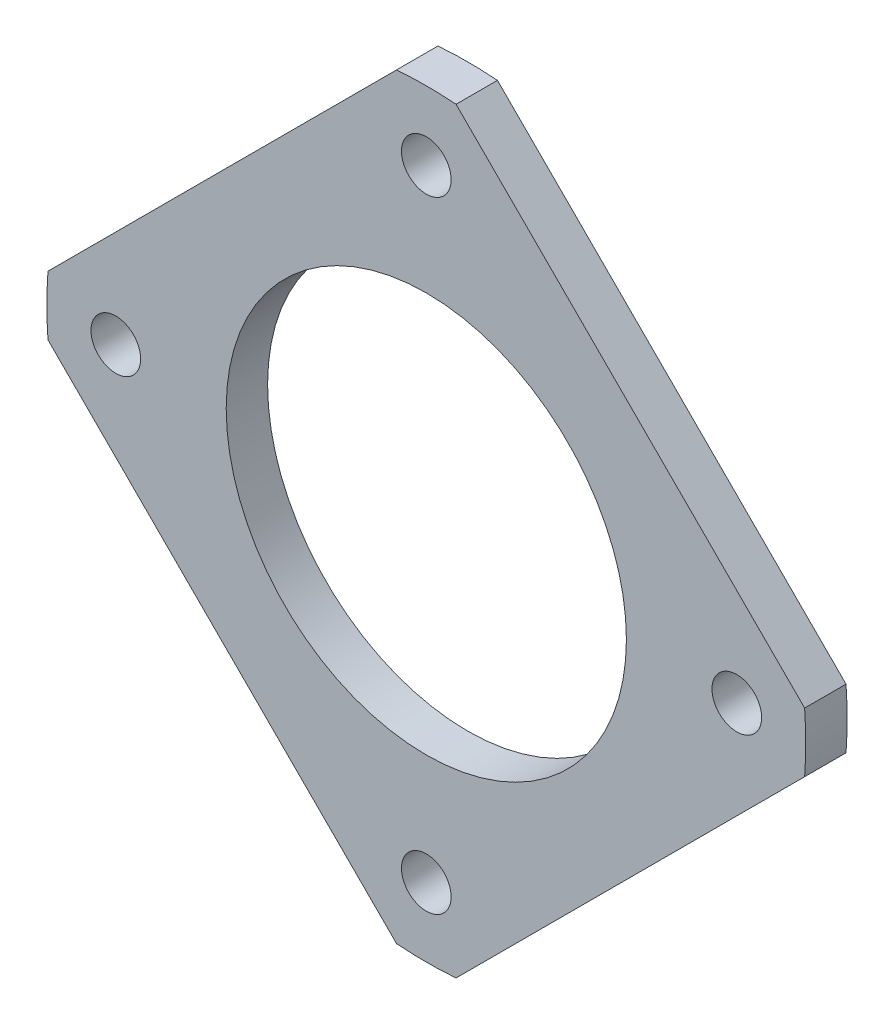
from build123d import *

# Parameters (mm, degrees)
SKETCH1_R            = 27.5
SKETCH1_R_2          = 14.5
SKETCH1_R_3          = 1.5
BOSS_EXTRUDE1_DEPTH  = 3
CUT_EXTRUDE1_START   = -10
CUT_EXTRUDE1_DEPTH   = 10
M3_CLEARANCE_HOLE1_D = 3.6


with BuildPart() as part:
    # Sketch1 → Boss-Extrude1 (new body)
    with BuildSketch(Plane.XY):
        Circle(SKETCH1_R)
        Circle(SKETCH1_R_2, mode=Mode.SUBTRACT)
        with Locations((0, 22.5)):
            Circle(SKETCH1_R_3, mode=Mode.SUBTRACT)
        with Locations((22.5, 0)):
            Circle(SKETCH1_R_3, mode=Mode.SUBTRACT)
        with Locations((0, -22.5)):
            Circle(SKETCH1_R_3, mode=Mode.SUBTRACT)
        with Locations((-22.5, 0)):
            Circle(SKETCH1_R_3, mode=Mode.SUBTRACT)
    extrude(amount=BOSS_EXTRUDE1_DEPTH)

    # Sketch2 → Cut-Extrude1 (cut)
    with BuildSketch(Plane.XY.offset(3).offset(CUT_EXTRUDE1_START)):
        with BuildLine():
            ThreePointArc((-2.155688811, 27.415379001), (-19.445436483, 19.445436483), (-27.415379001, 2.155688811))
            Line((-27.415379001, 2.155688811), (-2.155688811, 27.415379001))
        make_face()
        with BuildLine():
            ThreePointArc((27.415379001, 2.155688811), (19.445436483, 19.445436483), (2.155688811, 27.415379001))
            Line((2.155688811, 27.415379001), (27.415379001, 2.155688811))
        make_face()
        with BuildLine():
            Line((27.415379001, -2.155688811), (2.155688811, -27.415379001))
            ThreePointArc((2.155688811, -27.415379001), (19.445436483, -19.445436483), (27.415379001, -2.155688811))
        make_face()
        with BuildLine():
            Line((-2.155688811, -27.415379001), (-27.415379001, -2.155688811))
            ThreePointArc((-27.415379001, -2.155688811), (-19.445436483, -19.445436483), (-2.155688811, -27.415379001))
        make_face()
    extrude(amount=CUT_EXTRUDE1_DEPTH, mode=Mode.SUBTRACT)

    # M3 Clearance Hole1 (through all)
    with Locations(Plane.XY.offset(3)):
        with Locations((0, 22.5), (-22.5, 0), (0, -22.5), (22.5, 0)):
            Hole(M3_CLEARANCE_HOLE1_D / 2)


solid = part.part
